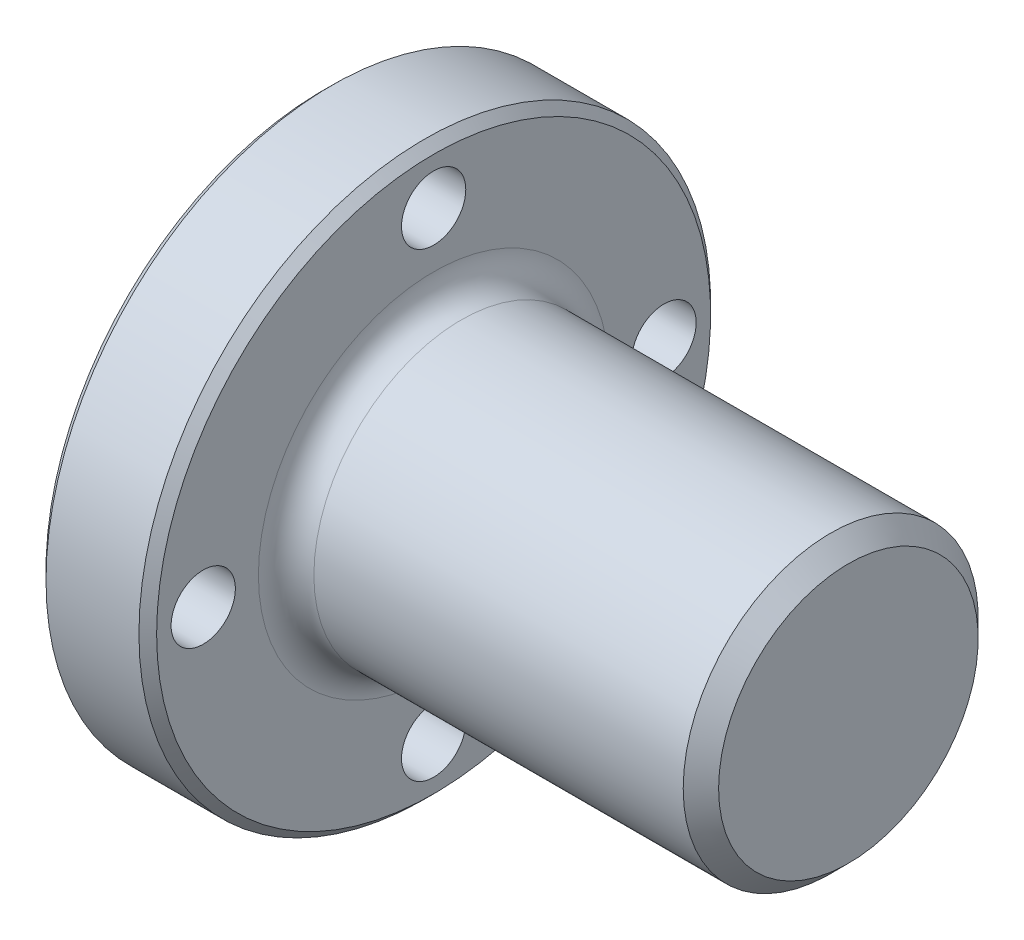
from build123d import *

# Parameters (mm, degrees)
FILLET1_R          = 2.3876
CHAMFER1_SIZE      = 0.762
CHAMFER2_SIZE      = 1.524
CUT_EXTRUDE2_START = -10.6807
SKETCH2_R          = 2.7686
CUT_EXTRUDE2_DEPTH = 10.6807


with BuildPart() as part:
    # Sketch1 → Revolve1 (revolve)
    with BuildSketch(Plane(origin=(0, 0, 0), x_dir=(1, 0, 0), z_dir=(0, 1, 0)), mode=Mode.PRIVATE) as revolve1_sk:
        Polygon((-25.0317, 0), (-25.0317, 8.7122), (-20.2057, 8.7122), (-20.2057, 24.6126), (-10.6807, 24.6126), (-10.6807, 12.7), (25.0317, 12.7), (25.0317, 0), align=None)
    revolve(revolve1_sk.sketch.rotate(Axis((-50.4317, 0, 0), (1, 0, 0)), 180), axis=Axis((-50.4317, 0, 0), (1, 0, 0)))

    # Fillet1
    fillet1_edges = [part.edges().sort_by_distance(p)[0] for p in [
        (-10.6807, 0, -12.7),
    ]]
    fillet(fillet1_edges, radius=FILLET1_R)

    # Chamfer1
    chamfer1_edges = [part.edges().sort_by_distance(p)[0] for p in [
        (-10.6807, 0, -24.6126),
        (-20.2057, 0, -24.6126),
        (-25.0317, 0, -8.7122),
    ]]
    chamfer(chamfer1_edges, length=CHAMFER1_SIZE)

    # Chamfer2
    chamfer2_edges = [part.edges().sort_by_distance(p)[0] for p in [
        (25.0317, 0, -12.7),
    ]]
    chamfer(chamfer2_edges, length=CHAMFER2_SIZE)

    # Sketch2 → Cut-Extrude2 (cut)
    with BuildSketch(Plane(origin=(0, 0, 0), x_dir=(0, 0, -1), z_dir=(1, 0, 0)).offset(CUT_EXTRUDE2_START)):
        with Locations((19.8374, 0)):
            Circle(SKETCH2_R)
        with Locations((0, 19.8374)):
            Circle(SKETCH2_R)
        with Locations((-19.8374, 0)):
            Circle(SKETCH2_R)
        with Locations((0, -19.8374)):
            Circle(SKETCH2_R)
    extrude(amount=-CUT_EXTRUDE2_DEPTH, mode=Mode.SUBTRACT)


solid = part.part
